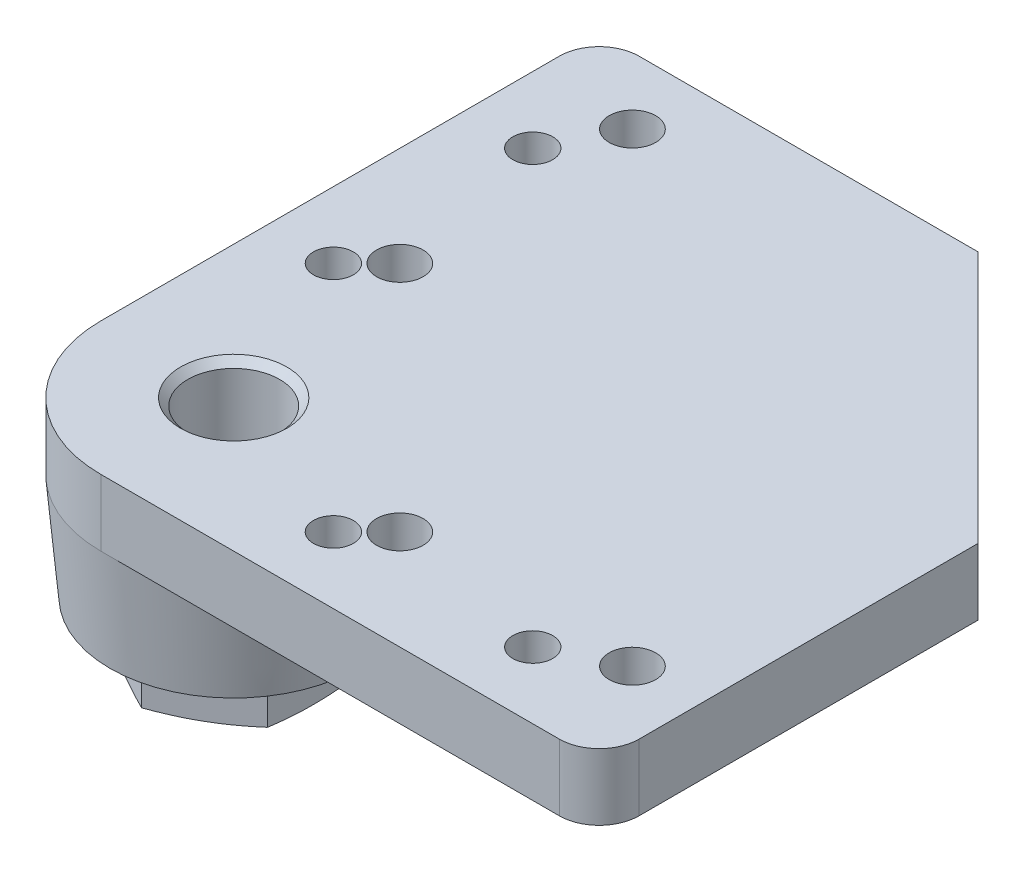
from build123d import *

# Parameters (mm, degrees)
SKETCH1_R           = 3.5
SKETCH1_R_2         = 3
BOSS_EXTRUDE1_DEPTH = 10
SKETCH2_R           = 20
BOSS_EXTRUDE2_DEPTH = 16
BOSS_EXTRUDE2_DRAFT = -5
SKETCH4_W           = 48
SKETCH4_H           = 48
CUT_EXTRUDE1_DEPTH  = 16
BOSS_EXTRUDE3_DEPTH = 2
BOSS_EXTRUDE3_DRAFT = -10


with BuildPart() as part:
    # Sketch1 → Boss-Extrude1 (new body)
    with BuildSketch(Plane(origin=(0, 0, 0), x_dir=(1, 0, 0), z_dir=(0, 1, 0))):
        with BuildLine():
            Line((-20, 69), (-20, 0))
            ThreePointArc((-20, 0), (-14.142135624, -14.142135624), (0, -20))
            Line((0, -20), (69, -20))
            ThreePointArc((69, -20), (73.242640687, -18.242640687), (75, -14))
            Line((75, -14), (75, 37))
            Line((75, 37), (37, 75))
            Line((37, 75), (-14, 75))
            ThreePointArc((-14, 75), (-18.242640687, 73.242640687), (-20, 69))
        make_face()
        with Locations(Location((65, -5, 0), (0, 0, 270))):
            Circle(SKETCH1_R, mode=Mode.SUBTRACT)
        with Locations(Location((55, -10, 0), (0, 0, 270))):
            Circle(SKETCH1_R_2, mode=Mode.SUBTRACT)
        with Locations(Location((30, -5, 0), (0, 0, 270))):
            Circle(SKETCH1_R, mode=Mode.SUBTRACT)
        with Locations(Location((25, -10, 0), (0, 0, 270))):
            Circle(SKETCH1_R_2, mode=Mode.SUBTRACT)
        with Locations(Location((-5, 65, 0), (0, 0, 270))):
            Circle(SKETCH1_R, mode=Mode.SUBTRACT)
        with Locations(Location((-5, 30, 0), (0, 0, 270))):
            Circle(SKETCH1_R, mode=Mode.SUBTRACT)
        with Locations(Location((-10, 55, 0), (0, 0, 270))):
            Circle(SKETCH1_R_2, mode=Mode.SUBTRACT)
        with Locations(Location((-10, 25, 0), (0, 0, 270))):
            Circle(SKETCH1_R_2, mode=Mode.SUBTRACT)
    extrude(amount=-BOSS_EXTRUDE1_DEPTH)


with BuildPart() as boss_extrude2_tool:
    # Sketch2 → Boss-Extrude2 (with draft: the straight prism first)
    with BuildSketch(Plane(origin=(0, -10, 0), x_dir=(1, 0, 0), z_dir=(0, 1, 0))):
        Circle(SKETCH2_R)
    extrude(amount=-BOSS_EXTRUDE2_DEPTH)
    # Boss-Extrude2: the draft: its side faces are tilted about the plane it starts from
    boss_extrude2_sides = [boss_extrude2_tool.faces().sort_by_distance(p)[0] for p in [
        (-20, -18, 0),
    ]]
    draft(boss_extrude2_sides, Plane(origin=(0, -10, 0), x_dir=(1, 0, 0), z_dir=(0, 1, 0)), BOSS_EXTRUDE2_DRAFT)


with BuildPart() as part_1:
    add(part.part)

    # Boss-Extrude2: add boss_extrude2_tool
    add(boss_extrude2_tool.part)

    # Sketch3 → Revolve1 (revolve)
    with BuildSketch(Plane.XY, mode=Mode.PRIVATE) as revolve1_sk:
        Polygon((0, -26), (12, -26), (14.4, -26.643078062), (14.4, -33.356921938), (12, -34), (0, -34), align=None)
    revolve(revolve1_sk.sketch.rotate(Axis((0, -34, 0), (0, 1, 0)), 270), axis=Axis((0, -34, 0), (0, 1, 0)))

    # Sketch4 → Cut-Extrude1 (cut)
    with BuildSketch(Plane(origin=(0, -26, 0), x_dir=(1, 0, 0), z_dir=(0, 1, 0))):
        Rectangle(SKETCH4_W, SKETCH4_H)
        Polygon((-12, 6.92820323), (-12, -6.92820323), (0, -13.856406461), (12, -6.92820323), (12, 6.92820323), (0, 13.856406461), align=None, mode=Mode.SUBTRACT)
    extrude(amount=-CUT_EXTRUDE1_DEPTH, mode=Mode.SUBTRACT)

    # Sketch5 → Cut-Revolve1 (revolve, cut)
    with BuildSketch(Plane.XY, mode=Mode.PRIVATE) as cut_revolve1_sk:
        Polygon((0, 0), (8, 0), (6.9175, -1.0825), (6.9175, -32.9175), (8, -34), (0, -34), align=None)
    revolve(cut_revolve1_sk.sketch.rotate(Axis((0, -34, 0), (0, 1, 0)), 270), axis=Axis((0, -34, 0), (0, 1, 0)), mode=Mode.SUBTRACT)


with BuildPart() as boss_extrude3_tool:
    # Sketch6 → Boss-Extrude3 (with draft: the straight prism first)
    with BuildSketch(Plane(origin=(0, -10, 0), x_dir=(1, 0, 0), z_dir=(0, 1, 0))):
        with BuildLine():
            Line((6.573950263, 34.573950263), (34.573950263, 6.573950263))
            ThreePointArc((34.573950263, 6.573950263), (38.109484168, 5.109484168), (41.645018074, 6.573950263))
            Line((41.645018074, 6.573950263), (69.929289322, 34.85822151))
            ThreePointArc((69.929289322, 34.85822151), (71.393755416, 38.393755416), (69.929289322, 41.929289322))
            Line((69.929289322, 41.929289322), (41.929289322, 69.929289322))
            ThreePointArc((41.929289322, 69.929289322), (38.393755416, 71.393755416), (34.85822151, 69.929289322))
            Line((34.85822151, 69.929289322), (6.573950263, 41.645018074))
            ThreePointArc((6.573950263, 41.645018074), (5.109484168, 38.109484168), (6.573950263, 34.573950263))
        make_face()
    extrude(amount=-BOSS_EXTRUDE3_DEPTH)
    # Boss-Extrude3: the draft: its side faces are tilted about the plane it starts from
    boss_extrude3_sides = [boss_extrude3_tool.faces().sort_by_distance(p)[0] for p in [
        (20.573950263, -11, -20.573950263),
        (38.109484168, -11, -5.109484168),
        (55.787153698, -11, -20.716085886),
        (71.393755416, -11, -38.393755416),
        (55.929289322, -11, -55.929289322),
        (38.393755416, -11, -71.393755416),
        (20.716085886, -11, -55.787153698),
        (5.109484168, -11, -38.109484168),
    ]]
    draft(boss_extrude3_sides, Plane(origin=(0, -10, 0), x_dir=(1, 0, 0), z_dir=(0, 1, 0)), BOSS_EXTRUDE3_DRAFT)


with BuildPart() as part_2:
    add(part_1.part)

    # Boss-Extrude3: add boss_extrude3_tool
    add(boss_extrude3_tool.part)

    # Sketch7 → Revolve2 (revolve)
    with BuildSketch(Plane(origin=(0, 0, 0), x_dir=(0.7071067811865475, 0, -0.7071067811865477), z_dir=(0.7071067811865477, 0, 0.7071067811865475)), mode=Mode.PRIVATE) as revolve2_sk:
        with BuildLine():
            Line((55, -12), (75, -12))
            Line((75, -12), (72.585786438, -14.414213562))
            ThreePointArc((72.585786438, -14.414213562), (71.93693974, -14.847759065), (71.171572875, -15))
            Line((71.171572875, -15), (55, -15))
            Line((55, -15), (55, -12))
        make_face()
    revolve(revolve2_sk.sketch.rotate(Axis((38.890872965, -15, -38.890872965), (0, 1, 0)), 225), axis=Axis((38.890872965, -15, -38.890872965), (0, 1, 0)))


solid = part_2.part
